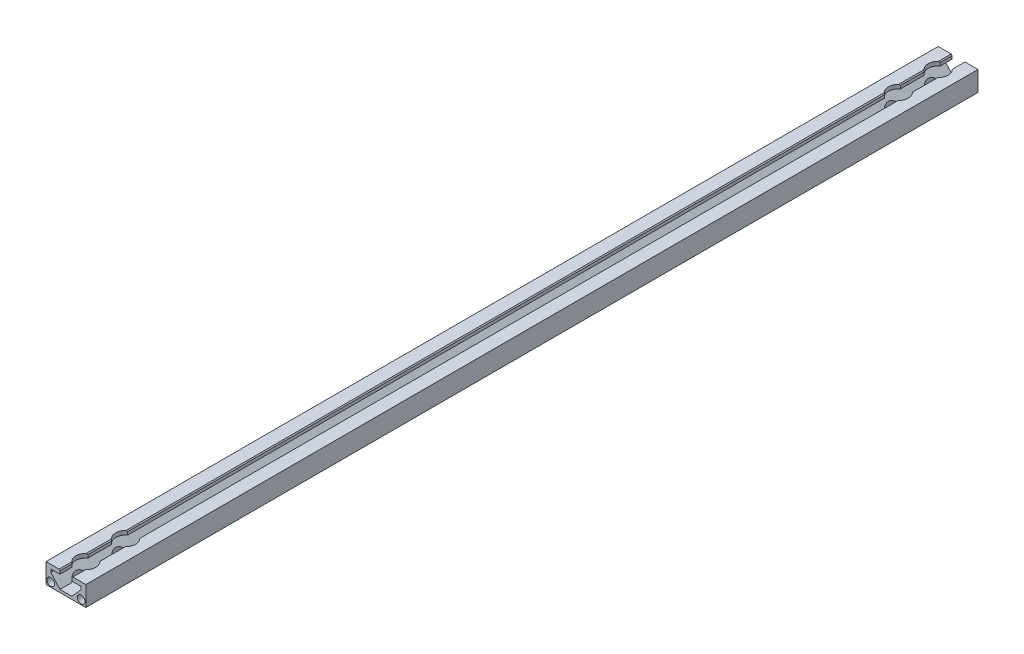
from build123d import *

# Parameters (mm, degrees)
BOSS_EXTRUDE1_DEPTH  = 224
SKETCH2_R            = 1.9
CUT_EXTRUDE1_DEPTH   = 449.194436663
SKETCH3_R            = 2.5
CUT_EXTRUDE2_DEPTH   = 225.445984593
M4_CLEARANCE_HOLE1_D = 4.8
CUT_EXTRUDE3_REACH   = 226.446
SKETCH6_R            = 5


with BuildPart() as part:
    # Sketch1 → Boss-Extrude1 (new, symmetric)
    with BuildSketch(Plane.XY):
        Polygon((0, 0), (0, -1.382978723), (10, -1.382978723), (10, 8.617021277), (3.448211747, 8.617021277), (3, 8.117021277), (3, 6.617021277), (7.587018089, 6.617021277), (7.587018089, 5.117021277), (3, 0), align=None)
    boss_extrude1 = extrude(amount=BOSS_EXTRUDE1_DEPTH, both=True)

    # Mirror1: Boss-Extrude1 across plane
    add(boss_extrude1.mirror(Plane(origin=(0, 0, 0), x_dir=(0, 0, 1), z_dir=(1, 0, 0))))

    # Sketch2 → Cut-Extrude1 (cut, through all)
    with BuildSketch(Plane.XY.offset(224)):
        with Locations((7.646716257, 0.97030502)):
            Circle(SKETCH2_R)
    cut_extrude1 = extrude(amount=-CUT_EXTRUDE1_DEPTH, mode=Mode.SUBTRACT)

    # Mirror2: Cut-Extrude1 across plane
    add(cut_extrude1.mirror(Plane(origin=(0, 0, 0), x_dir=(0, 0, 1), z_dir=(1, 0, 0))), mode=Mode.SUBTRACT)

    # Sketch3 → Cut-Extrude2 (cut, through all)
    with BuildSketch(Plane.XZ.offset(1.382978723)):
        with Locations(Location((0, 140, 0), (0, 0, 270))):
            Circle(SKETCH3_R)
        with Locations(Location((0, -140, 0), (0, 0, 270))):
            Circle(SKETCH3_R)
    extrude(amount=-CUT_EXTRUDE2_DEPTH, mode=Mode.SUBTRACT)

    # M4 Clearance Hole1 (through all)
    with Locations(Plane(origin=(0, -1.382978723, 0), x_dir=(-1, 0, 0), z_dir=(0, -1, 0))):
        with Locations((0, -214), (0, -194)):
            m4_clearance_hole1 = Hole(M4_CLEARANCE_HOLE1_D / 2)

    # Mirror3: M4 Clearance Hole1 across plane
    add(m4_clearance_hole1.mirror(Plane.XY), mode=Mode.SUBTRACT)

    # Cut-Extrude3: up to this face of the body (flat: up to its plane)
    cut_extrude3_end = Plane(part.part.faces().sort_by_distance((0, 0, 0))[0])
    # Sketch6 → Cut-Extrude3 (cut, up to the picked face)
    with BuildSketch(Plane(origin=(0, 8.617021277, 0), x_dir=(1, 0, 0), z_dir=(0, 1, 0)), mode=Mode.PRIVATE) as cut_extrude3_sk1:
        with Locations((0, -214)):
            Circle(SKETCH6_R)
    cut_extrude3_tool1 = split(extrude(cut_extrude3_sk1.sketch, amount=-CUT_EXTRUDE3_REACH, mode=Mode.PRIVATE), bisect_by=cut_extrude3_end, keep=Keep.BOTH, mode=Mode.PRIVATE)
    # Sketch6 → Cut-Extrude3 (cut, up to the picked face)
    with BuildSketch(Plane(origin=(0, 8.617021277, 0), x_dir=(1, 0, 0), z_dir=(0, 1, 0)), mode=Mode.PRIVATE) as cut_extrude3_sk2:
        with Locations((0, -194)):
            Circle(SKETCH6_R)
    cut_extrude3_tool2 = split(extrude(cut_extrude3_sk2.sketch, amount=-CUT_EXTRUDE3_REACH, mode=Mode.PRIVATE), bisect_by=cut_extrude3_end, keep=Keep.BOTH, mode=Mode.PRIVATE)
    cut_extrude3_1 = cut_extrude3_tool1.solids().sort_by(Axis((0, 8.617021, 214), (0, -1, 0)))[0]
    add(cut_extrude3_1, mode=Mode.SUBTRACT)
    cut_extrude3_2 = cut_extrude3_tool2.solids().sort_by(Axis((0, 8.617021, 194), (0, -1, 0)))[0]
    add(cut_extrude3_2, mode=Mode.SUBTRACT)
    cut_extrude3 = cut_extrude3_1 + cut_extrude3_2  # Cut-Extrude3 as one shape, for the pattern or mirror that repeats it

    # Mirror4: Cut-Extrude3 across plane
    add(cut_extrude3.mirror(Plane.XY), mode=Mode.SUBTRACT)


solid = part.part
